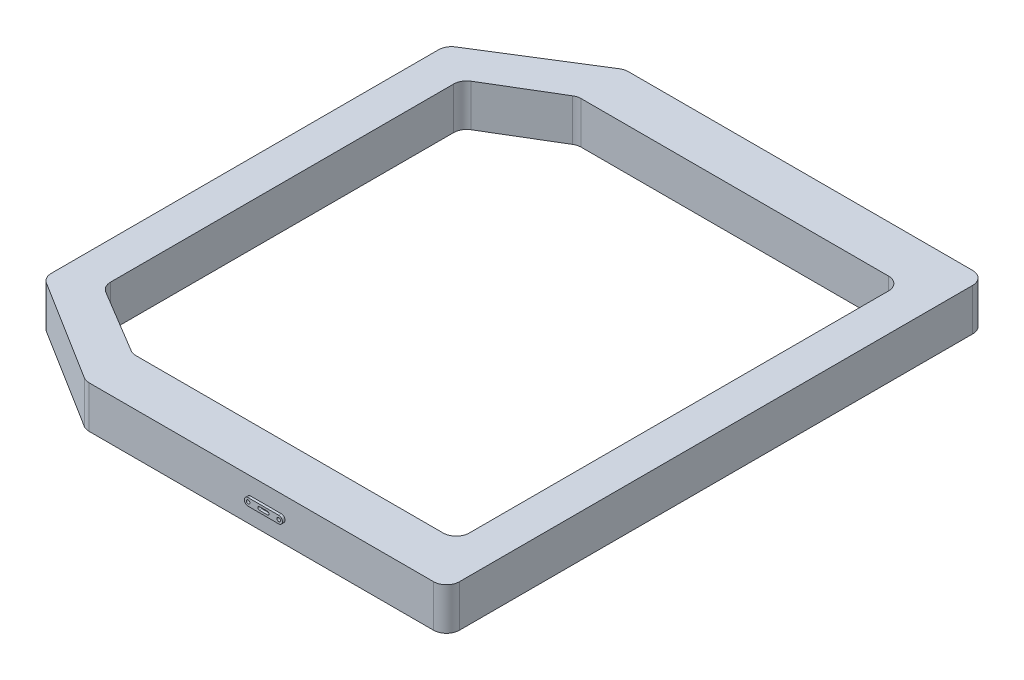
from build123d import *

# Parameters (mm, degrees)
SALIENTE_EXTRUIR2_DEPTH = 41.275
CROQUIS2_5_OUTSIDE_W    = 604.615
CROQUIS2_5_OUTSIDE_H    = 671.29
CORTAR_EXTRUIR2_DEPTH   = 41.275
SALIENTE_EXTRUIR4_DEPTH = 2.54
CROQUIS3_5_OUTSIDE_W    = 604.997
CROQUIS3_5_OUTSIDE_H    = 184.309
CROQUIS3_5_OUTSIDE_R    = 1.735738664
CORTAR_EXTRUIR3_DEPTH   = 2.54
REDONDEO1_R             = 12.7
REDONDEO2_R             = 12.7
REDONDEO3_R             = 12.7
REDONDEO4_R             = 12.7
REDONDEO5_R             = 12.7
REDONDEO6_R             = 12.7
REDONDEO7_R             = 12.7
REDONDEO8_R             = 12.7
REDONDEO9_R             = 12.7
REDONDEO10_R            = 12.7
REDONDEO11_R            = 12.7
REDONDEO12_R            = 12.7


with BuildPart() as part:
    # Croquis2 → Saliente-Extruir2 (new body)
    with BuildSketch(Plane(origin=(0, 0, 0), x_dir=(1, 0, 0), z_dir=(0, 1, 0))):
        Polygon((409.380647902, 498.22250712), (409.380647902, -30.41499288), (55.368147902, -30.41499288), (-52.581852098, 37.05375712), (-52.581852098, 430.75375712), (55.368147902, 498.22250712), align=None)
    extrude(amount=SALIENTE_EXTRUIR2_DEPTH)

    # Croquis2<5> outside → Cortar-Extruir2 (cut)
    # profile 1 of 2: a face of its own
    with BuildSketch(Plane(origin=(0, 0, 0), x_dir=(1, 0, 0), z_dir=(0, 1, 0))):
        with Locations((178.3995, 233.904)):
            Rectangle(CROQUIS2_5_OUTSIDE_W, CROQUIS2_5_OUTSIDE_H)
        Polygon((409.380647902, 498.22250712), (409.380647902, -30.41499288), (55.368147902, -30.41499288), (-52.581852098, 37.05375712), (-52.581852098, 430.75375712), (55.368147902, 498.22250712), align=None, mode=Mode.SUBTRACT)
    # profile 2 of 2: a face of its own
    with BuildSketch(Plane(origin=(0, 0, 0), x_dir=(1, 0, 0), z_dir=(0, 1, 0))):
        Polygon((55.368147902, 15.62250712), (372.868147902, 15.62250712), (372.868147902, 452.18500712), (55.368147902, 452.18500712), (-16.069352098, 409.32250712), (-16.069352098, 58.48500712), align=None)
    extrude(amount=CORTAR_EXTRUIR2_DEPTH, mode=Mode.SUBTRACT)

    # Croquis3 → Saliente-Extruir4 (add)
    with BuildSketch(Plane.XY.offset(30.41499288)):
        with BuildLine():
            Line((217.386255897, 24.306608413), (247.362539906, 24.306608413))
            ThreePointArc((247.362539906, 24.306608413), (251.03164832, 20.6375), (247.362539906, 16.968391587))
            Line((247.362539906, 16.968391587), (217.386255897, 16.968391587))
            ThreePointArc((217.386255897, 16.968391587), (213.717147484, 20.6375), (217.386255897, 24.306608413))
        make_face()
    extrude(amount=SALIENTE_EXTRUIR4_DEPTH)

    # Croquis3<5> outside → Cortar-Extruir3 (cut)
    # profile 1 of 4: a face of its own
    with BuildSketch(Plane.XY.offset(30.41499288)):
        with Locations((178.3995, 20.6375)):
            Rectangle(CROQUIS3_5_OUTSIDE_W, CROQUIS3_5_OUTSIDE_H)
        with BuildLine():
            Line((217.386255897, 24.306608413), (247.362539906, 24.306608413))
            ThreePointArc((247.362539906, 24.306608413), (251.03164832, 20.6375), (247.362539906, 16.968391587))
            Line((247.362539906, 16.968391587), (217.386255897, 16.968391587))
            ThreePointArc((217.386255897, 16.968391587), (213.717147484, 20.6375), (217.386255897, 24.306608413))
        make_face(mode=Mode.SUBTRACT)
    # profile 2 of 4: a face of its own
    with BuildSketch(Plane.XY.offset(30.41499288)):
        with Locations((217.386255897, 20.6375)):
            Circle(CROQUIS3_5_OUTSIDE_R)
    # profile 3 of 4: a face of its own
    with BuildSketch(Plane.XY.offset(30.41499288)):
        with Locations((247.362539906, 20.6375)):
            Circle(CROQUIS3_5_OUTSIDE_R)
    # profile 4 of 4: a face of its own
    with BuildSketch(Plane.XY.offset(30.41499288)):
        with BuildLine():
            Line((228.433365542, 22.195071447), (236.315430261, 22.195071447))
            ThreePointArc((236.315430261, 22.195071447), (237.873001708, 20.6375), (236.315430261, 19.079928553))
            Line((236.315430261, 19.079928553), (228.433365542, 19.079928553))
            ThreePointArc((228.433365542, 19.079928553), (226.875794095, 20.6375), (228.433365542, 22.195071447))
        make_face()
    extrude(amount=CORTAR_EXTRUIR3_DEPTH, mode=Mode.SUBTRACT)

    # Redondeo1
    redondeo1_edges = [part.edges().sort_by_distance(p)[0] for p in [
        (372.868147902, 20.6375, -452.18500712),
    ]]
    fillet(redondeo1_edges, radius=REDONDEO1_R)

    # Redondeo2
    redondeo2_edges = [part.edges().sort_by_distance(p)[0] for p in [
        (372.868147902, 20.6375, -15.62250712),
    ]]
    fillet(redondeo2_edges, radius=REDONDEO2_R)

    # Redondeo3
    redondeo3_edges = [part.edges().sort_by_distance(p)[0] for p in [
        (-16.069352098, 20.6375, -409.32250712),
    ]]
    fillet(redondeo3_edges, radius=REDONDEO3_R)

    # Redondeo4
    redondeo4_edges = [part.edges().sort_by_distance(p)[0] for p in [
        (55.368147902, 20.6375, -452.18500712),
    ]]
    fillet(redondeo4_edges, radius=REDONDEO4_R)

    # Redondeo5
    redondeo5_edges = [part.edges().sort_by_distance(p)[0] for p in [
        (55.368147902, 20.6375, -15.62250712),
    ]]
    fillet(redondeo5_edges, radius=REDONDEO5_R)

    # Redondeo6
    redondeo6_edges = [part.edges().sort_by_distance(p)[0] for p in [
        (-16.069352098, 20.6375, -58.48500712),
    ]]
    fillet(redondeo6_edges, radius=REDONDEO6_R)

    # Redondeo7
    redondeo7_edges = [part.edges().sort_by_distance(p)[0] for p in [
        (55.368147902, 20.6375, 30.41499288),
    ]]
    fillet(redondeo7_edges, radius=REDONDEO7_R)

    # Redondeo8
    redondeo8_edges = [part.edges().sort_by_distance(p)[0] for p in [
        (-52.581852098, 20.6375, -37.05375712),
    ]]
    fillet(redondeo8_edges, radius=REDONDEO8_R)

    # Redondeo9
    redondeo9_edges = [part.edges().sort_by_distance(p)[0] for p in [
        (-52.581852098, 20.6375, -430.75375712),
    ]]
    fillet(redondeo9_edges, radius=REDONDEO9_R)

    # Redondeo10
    redondeo10_edges = [part.edges().sort_by_distance(p)[0] for p in [
        (55.368147902, 20.6375, -498.22250712),
    ]]
    fillet(redondeo10_edges, radius=REDONDEO10_R)

    # Redondeo11
    redondeo11_edges = [part.edges().sort_by_distance(p)[0] for p in [
        (409.380647902, 20.6375, 30.41499288),
    ]]
    fillet(redondeo11_edges, radius=REDONDEO11_R)

    # Redondeo12
    redondeo12_edges = [part.edges().sort_by_distance(p)[0] for p in [
        (409.380647902, 20.6375, -498.22250712),
    ]]
    fillet(redondeo12_edges, radius=REDONDEO12_R)


solid = part.part
